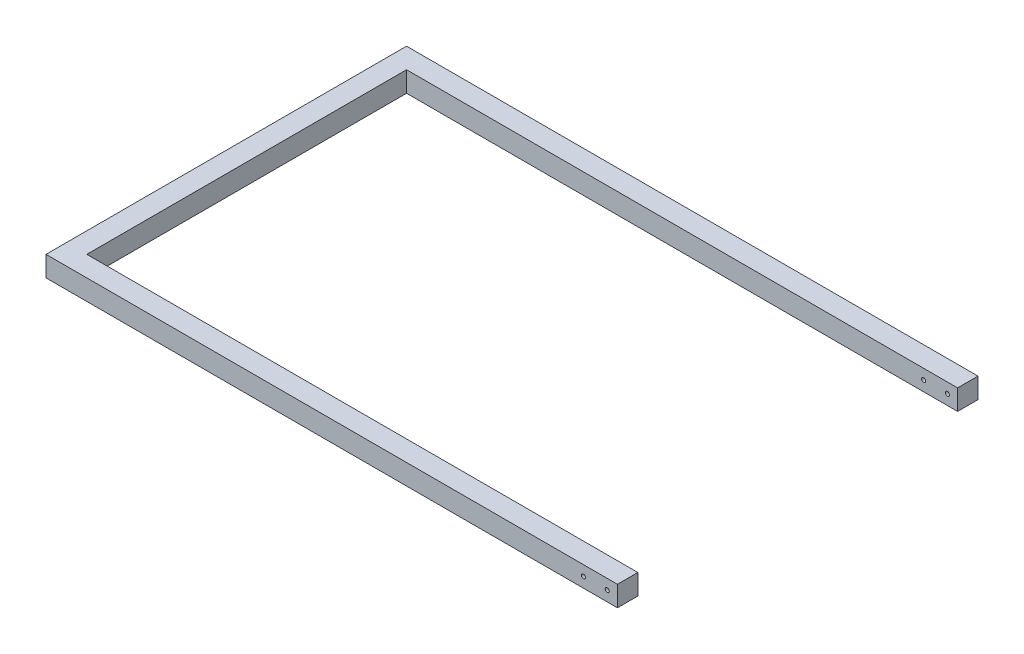
from build123d import *

# Parameters (mm, degrees)
SKETCH_1_W               = 1980
SKETCH_1_H               = 530
SKETCH_1_W_2             = 1920
SKETCH_1_H_2             = 470
EXTRUDE_1_DEPTH          = 30
SKETCH_2_W               = 68
SKETCH_2_H               = 30
EXTRUDE_2_DEPTH          = 68
SKETCH_3_R               = 23.5
CUT_EXTRUDE_1_DEPTH      = 1125.999555555
SKETCH_4_W               = 31
SKETCH_4_H               = 470
EXTRUDE_3_DEPTH          = 30
SKETCH_5_R               = 3
CUT_EXTRUDE_2_DEPTH      = 1030.528532873
SKETCH_6_R               = 3
CUT_EXTRUDE_3_DEPTH      = 1030.528532873
SKETCH_7_W               = 1260.245327066
SKETCH_7_H               = 30
CUT_EXTRUDE_4_DEPTH      = 1125.999555555
CUT_EXTRUDE_5_DEPTH      = 1124.343224487
CUT_EXTRUDE_5_DEPTH_BACK = 1124.343224487
SKETCH_8_R               = 3
SKETCH_9_R               = 3
CUT_EXTRUDE_6_DEPTH      = 1124.343224487


with BuildPart() as part:
    # 草图1 → 凸台-拉伸1 (new body)
    with BuildSketch(Plane(origin=(0, 0, 0), x_dir=(1, 0, 0), z_dir=(0, 1, 0))):
        Rectangle(SKETCH_1_W, SKETCH_1_H)
        Rectangle(SKETCH_1_W_2, SKETCH_1_H_2, mode=Mode.SUBTRACT)
    extrude(amount=EXTRUDE_1_DEPTH)

    # 草图2 → 凸台-拉伸2 (add)
    with BuildSketch(Plane.XZ):
        with Locations((0, 250)):
            Rectangle(SKETCH_2_W, SKETCH_2_H)
        with Locations((0, -250)):
            Rectangle(SKETCH_2_W, SKETCH_2_H)
    extrude(amount=EXTRUDE_2_DEPTH)

    # 草图3 → 切除-拉伸1 (cut, through all)
    with BuildSketch(Plane.XY.offset(265)):
        with Locations((0, -30)):
            Circle(SKETCH_3_R)
    extrude(amount=-CUT_EXTRUDE_1_DEPTH, mode=Mode.SUBTRACT)

    # 草图4 → 凸台-拉伸3 (add)
    with BuildSketch(Plane(origin=(0, 30, 0), x_dir=(1, 0, 0), z_dir=(0, 1, 0))):
        with Locations((764.5, 0)):
            Rectangle(SKETCH_4_W, SKETCH_4_H)
    extrude(amount=-EXTRUDE_3_DEPTH)

    # 草图5 → 切除-拉伸2 (cut, through all)
    with BuildSketch(Plane(origin=(0, 30, 0), x_dir=(1, 0, 0), z_dir=(0, 1, 0))):
        with Locations(Location((759, 180, 0), (0, 0, 270))):
            Circle(SKETCH_5_R)
        with Locations(Location((774.5, 180, 0), (0, 0, 270))):
            Circle(SKETCH_5_R)
        with Locations(Location((759, -180, 0), (0, 0, 270))):
            Circle(SKETCH_5_R)
        with Locations(Location((774.5, -180, 0), (0, 0, 270))):
            Circle(SKETCH_5_R)
    extrude(amount=-CUT_EXTRUDE_2_DEPTH, mode=Mode.SUBTRACT)

    # 草图6 → 切除-拉伸3 (cut, symmetric)
    with BuildSketch(Plane(origin=(0, 30, 0), x_dir=(1, 0, 0), z_dir=(0, 1, 0))):
        with Locations(Location((840, -250, 0), (0, 0, 270))):
            Circle(SKETCH_6_R)
    cut_extrude_3 = extrude(amount=CUT_EXTRUDE_3_DEPTH, both=True, mode=Mode.SUBTRACT)

    # 镜向1: 切除-拉伸3 across plane
    add(cut_extrude_3.mirror(Plane.XY), mode=Mode.SUBTRACT)

    # 草图7 → 切除-拉伸4 (cut, through all)
    with BuildSketch(Plane.XY.offset(265)):
        with Locations((480.122663533, 15)):
            Rectangle(SKETCH_7_W, SKETCH_7_H)
    extrude(amount=-CUT_EXTRUDE_4_DEPTH, mode=Mode.SUBTRACT)


with BuildPart() as body_2:
    # of the pieces the cut leaves, the one that is kept (cut_extrude_4_keep)
    add(part.part.solids().sort_by_distance((-990, 0, -265))[0])

    # 草图8 → 切除-拉伸5 (cut, two sides: drawn at the far end of the back side and taken through both)
    with BuildSketch(Plane.XY.offset(265).offset(-CUT_EXTRUDE_5_DEPTH_BACK)):
        with Locations(Location((-200, 15, 0), (0, 0, 180))):
            Circle(SKETCH_8_R)
    extrude(amount=CUT_EXTRUDE_5_DEPTH + CUT_EXTRUDE_5_DEPTH_BACK, mode=Mode.SUBTRACT)

    # 草图9 → 切除-拉伸6 (cut, through all)
    with BuildSketch(Plane.XY.offset(265)):
        with Locations((-165, 15)):
            Circle(SKETCH_9_R)
    extrude(amount=-CUT_EXTRUDE_6_DEPTH, mode=Mode.SUBTRACT)


solid = body_2.part
